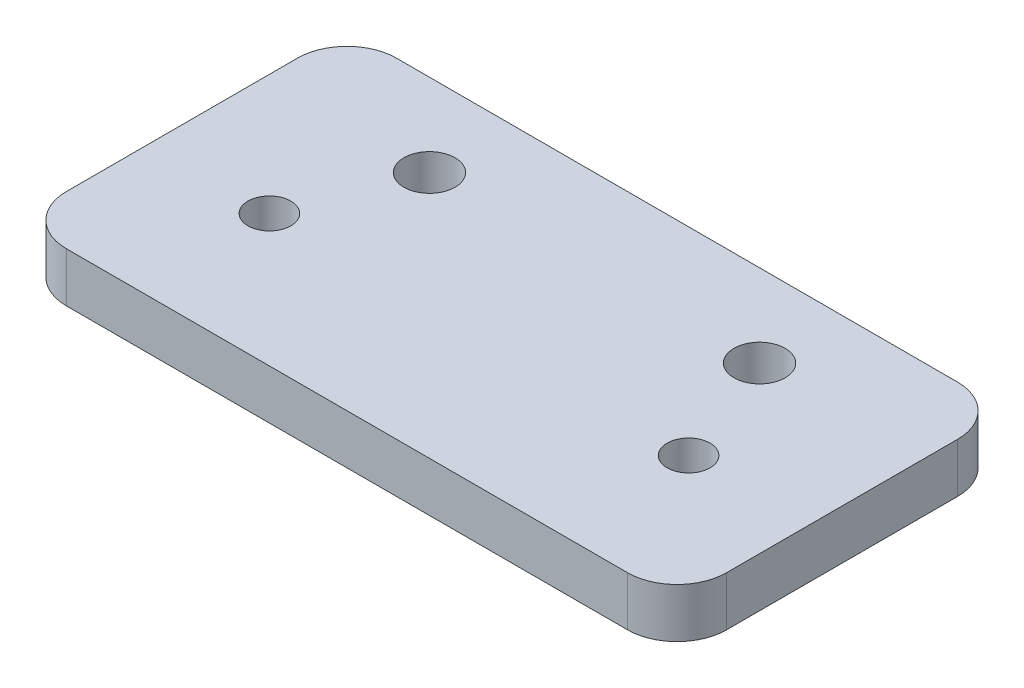
from build123d import *

# Parameters (mm, degrees)
SKETCH_1_W          = 40
SKETCH_1_H          = 30
EXTRUDE_1_DEPTH     = 3
SKETCH_2_R          = 1.55
CUT_EXTRUDE_1_DEPTH = 26.179356624
SKETCH_3_W          = 40
SKETCH_3_H          = 10
CUT_EXTRUDE_2_DEPTH = 26.179356624
FILLET_2_R          = 3
SKETCH_4_R          = 1.3
CUT_EXTRUDE_3_DEPTH = 26.179356624


with BuildPart() as part:
    # 草图1 → 凸台-拉伸1 (new body)
    with BuildSketch(Plane(origin=(0, 0, 0), x_dir=(1, 0, 0), z_dir=(0, 1, 0))):
        Rectangle(SKETCH_1_W, SKETCH_1_H)
    extrude(amount=EXTRUDE_1_DEPTH)

    # 草图2 → 切除-拉伸1 (cut, through all)
    with BuildSketch(Plane(origin=(0, 3, 0), x_dir=(1, 0, 0), z_dir=(0, 1, 0))):
        with Locations(Location((-10, 0, 0), (0, 0, 270))):
            Circle(SKETCH_2_R)
        with Locations(Location((10, 0, 0), (0, 0, 90))):
            Circle(SKETCH_2_R)
    extrude(amount=-CUT_EXTRUDE_1_DEPTH, mode=Mode.SUBTRACT)

    # 草图3 → 切除-拉伸2 (cut, through all)
    with BuildSketch(Plane(origin=(0, 3, 0), x_dir=(1, 0, 0), z_dir=(0, 1, 0))):
        with Locations((0, 10)):
            Rectangle(SKETCH_3_W, SKETCH_3_H)
    extrude(amount=-CUT_EXTRUDE_2_DEPTH, mode=Mode.SUBTRACT)

    # 圆角2
    fillet_2_edges = [part.edges().sort_by_distance(p)[0] for p in [
        (-20, 1.5, -5),
        (20, 1.5, -5),
        (20, 1.5, 15),
        (-20, 1.5, 15),
    ]]
    fillet(fillet_2_edges, radius=FILLET_2_R)

    # 草图4 → 切除-拉伸3 (cut, through all)
    with BuildSketch(Plane(origin=(0, 3, 0), x_dir=(1, 0, 0), z_dir=(0, 1, 0))):
        with Locations(Location((-12.7, -7, 0), (0, 0, 270))):
            Circle(SKETCH_4_R)
        with Locations(Location((12.7, -7, 0), (0, 0, 90))):
            Circle(SKETCH_4_R)
    extrude(amount=-CUT_EXTRUDE_3_DEPTH, mode=Mode.SUBTRACT)


solid = part.part
